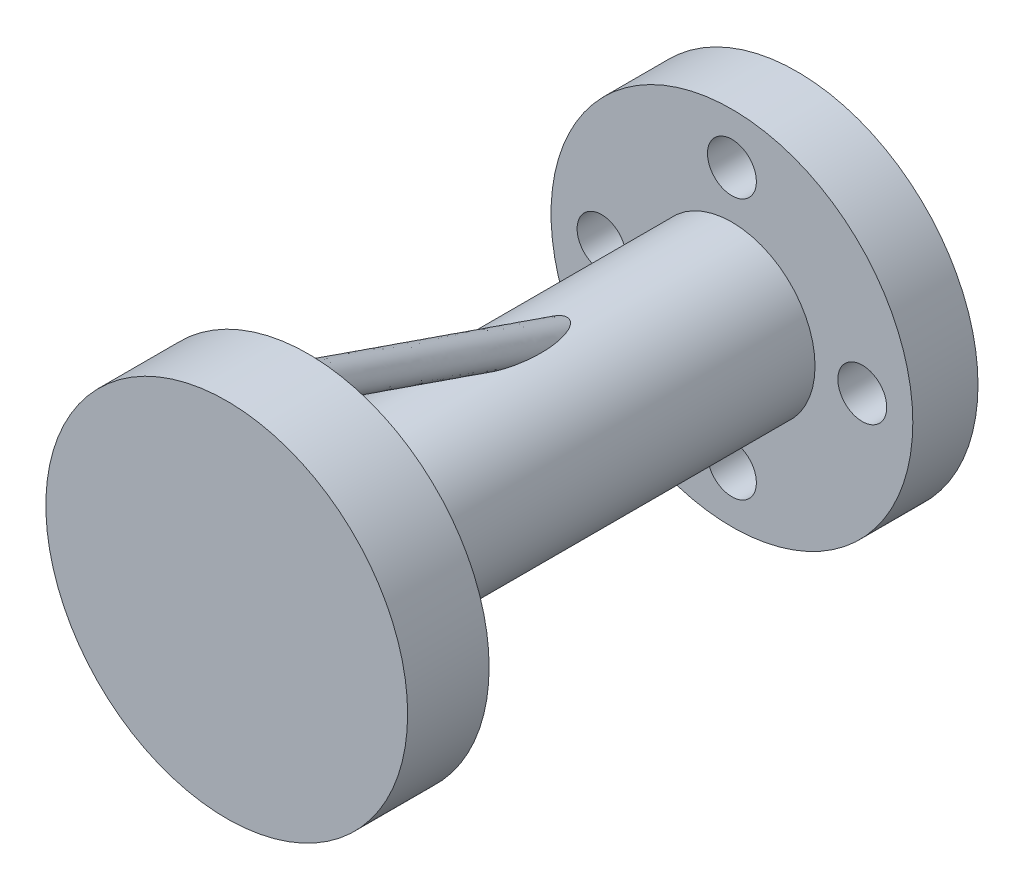
from build123d import *

# Parameters (mm, degrees)
SKETCH3_R           = 11.1
SKETCH3_R_2         = 5.1
SKETCH3_R_3         = 1.5
BOSS_EXTRUDE5_DEPTH = 4
SKETCH16_R          = 5.1
BOSS_EXTRUDE6_DEPTH = 30
SKETCH17_R          = 11.1
BOSS_EXTRUDE8_DEPTH = 5
SKETCH19_R          = 1


with BuildPart() as part:
    # Sketch3 → Boss-Extrude5 (new body)
    with BuildSketch(Plane.XY):
        Circle(SKETCH3_R)
        Circle(SKETCH3_R_2, mode=Mode.SUBTRACT)
        with Locations((0, 8)):
            Circle(SKETCH3_R_3, mode=Mode.SUBTRACT)
        with Locations((8, 0)):
            Circle(SKETCH3_R_3, mode=Mode.SUBTRACT)
        with Locations((0, -8)):
            Circle(SKETCH3_R_3, mode=Mode.SUBTRACT)
        with Locations((-8, 0)):
            Circle(SKETCH3_R_3, mode=Mode.SUBTRACT)
    extrude(amount=BOSS_EXTRUDE5_DEPTH)

    # Sketch16 → Boss-Extrude6 (add)
    with BuildSketch(Plane(origin=(0, 0, 0), x_dir=(-1, 0, 0), z_dir=(0, 0, -1))):
        Circle(SKETCH16_R)
    extrude(amount=-BOSS_EXTRUDE6_DEPTH)

    # Sketch17 → Boss-Extrude8 (add)
    with BuildSketch(Plane.XY.offset(30)):
        Circle(SKETCH17_R)
    extrude(amount=BOSS_EXTRUDE8_DEPTH)

    # Sweep1: sweep along a path in Sketch20
    with BuildLine(Plane(origin=(0, 0, 0), x_dir=(0, 0, -1), z_dir=(1, 0, 0))) as sweep1_path:
        Line((-30, 9.6), (-12.990250678, 3.71200985))
    # Sketch19 → Sweep1 (sweep)
    with BuildSketch(Plane(origin=(0, 0, 30), x_dir=(-1, 0, 0), z_dir=(0, 0, -1))):
        with Locations((0, 9.6)):
            Circle(SKETCH19_R)
    sweep(path=sweep1_path.line)


solid = part.part
